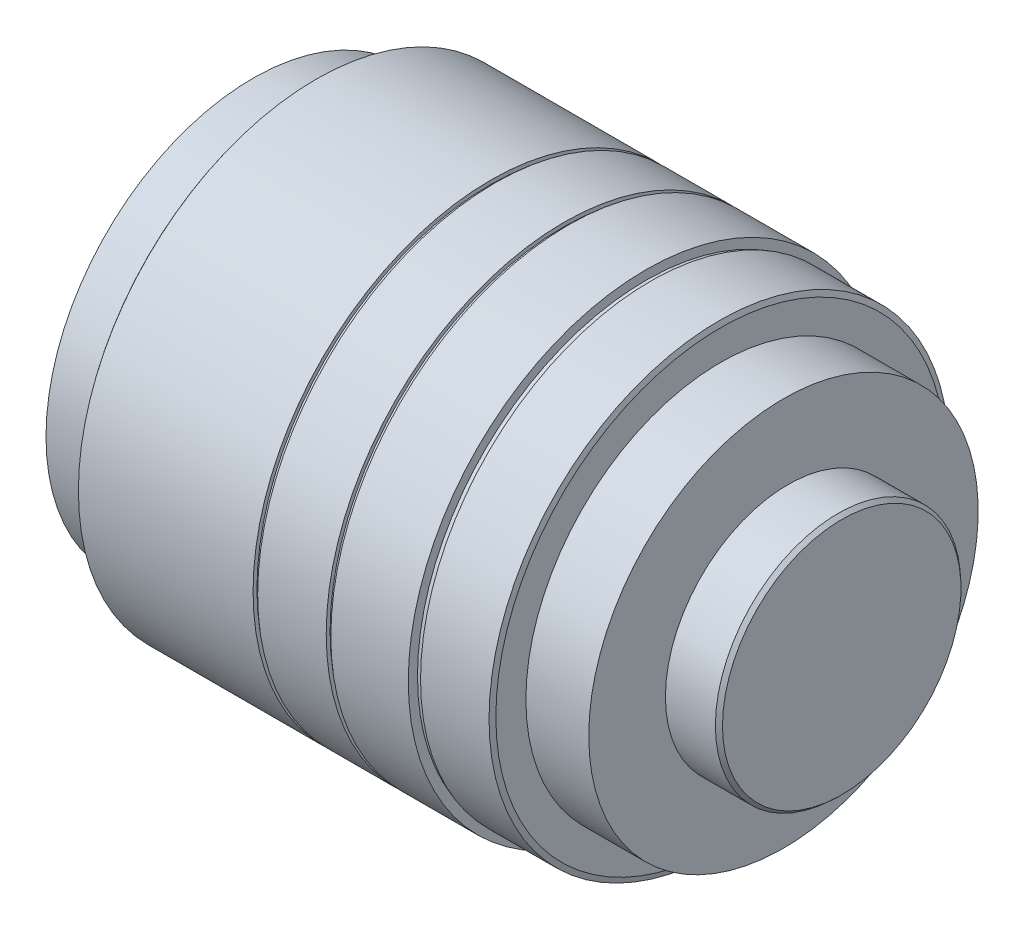
from build123d import *


with BuildPart() as part:
    # Sketch1 → Revolve1 (revolve)
    with BuildSketch(Plane.XY, mode=Mode.PRIVATE) as revolve1_sk:
        Polygon((-38.4, 0), (-38.4, 13.5), (-34.4, 13.5), (-34.4, 15.354591962), (-34.287468985, 15.5), (-22.895018976, 15.5), (-22.895018976, 15.246920735), (-22.595018976, 15.246920735), (-22.595018976, 15.5), (-18.123640766, 15.5), (-18.123640766, 15.246920735), (-17.823640766, 15.246920735), (-17.823640766, 15.5), (-12.771458761, 15.5), (-12.771458761, 14.899770288), (-12.471458761, 14.899770288), (-12.471458761, 15), (-8.004107003, 15), (-7.9, 14.660301421), (-7.9, 12.7), (-3.799837925, 12.7), (-3.799837925, 7.515096405), (-3.499837925, 7.515096405), (-3.499837925, 8), (-0.240891884, 8), (0, 7.777504369), (0, 0), align=None)
    revolve(revolve1_sk.sketch.rotate(Axis((-61.595871807, 0, 0), (1, 0, 0)), 90), axis=Axis((-61.595871807, 0, 0), (1, 0, 0)))

    # Sketch2 → Revolve2 (revolve)
    with BuildSketch(Plane(origin=(0, 0, 0), x_dir=(1, 0, 0), z_dir=(0, 1, 0))):
        with BuildLine():
            Line((-38.4, -9.112860892), (-38.4, 0))
            Line((-38.4, 0), (-40.611277306, 0))
            ThreePointArc((-40.611277306, 0), (-40.124324385, -4.706557364), (-38.4, -9.112860892))
        make_face()
    revolve(axis=Axis((-49.369562138, 0, 0), (1, 0, 0)))


solid = part.part
